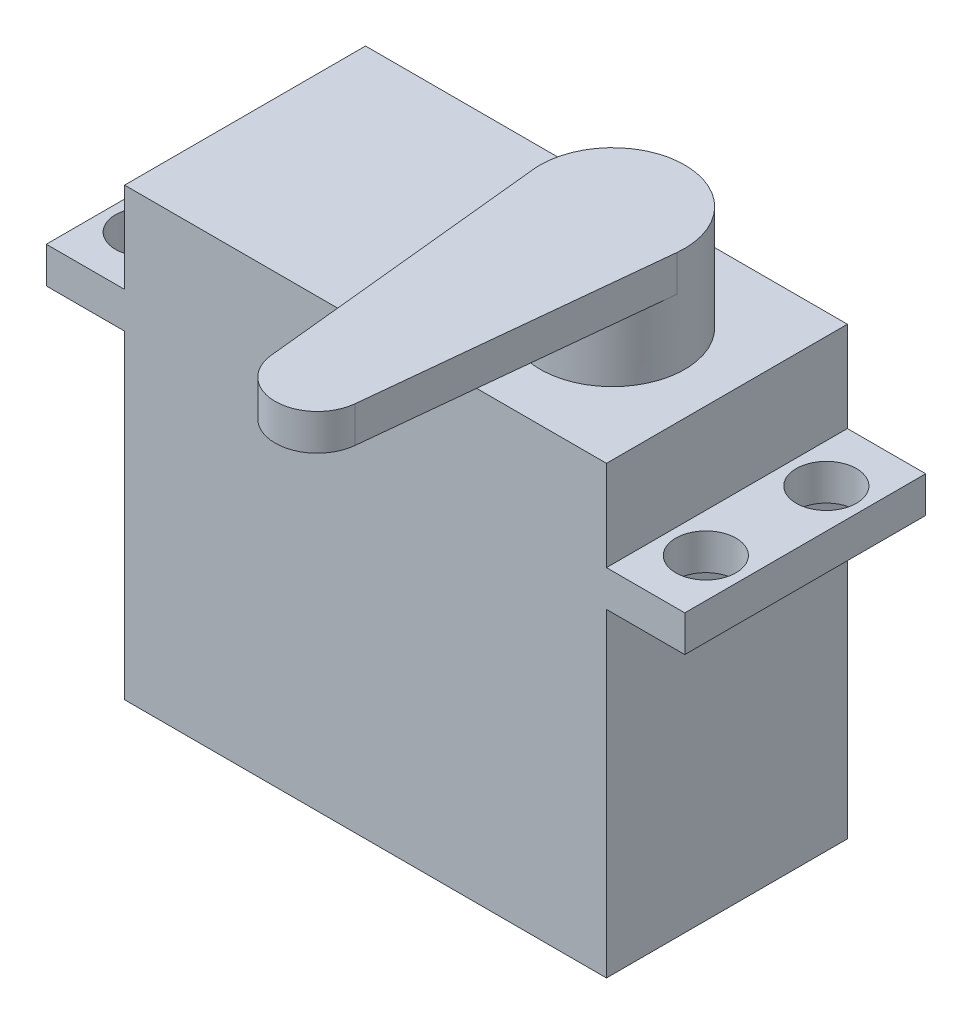
from build123d import *

# Parameters (mm, degrees)
SKETCH1_W           = 40
SKETCH1_H           = 37
BOSS_EXTRUDE1_DEPTH = 20
SKETCH2_W           = 6.5
SKETCH2_H           = 3
BOSS_EXTRUDE2_DEPTH = 20
BOSS_EXTRUDE3_DEPTH = 8.7
BOSS_EXTRUDE4_DEPTH = 3
CUT_EXTRUDE2_REACH  = 67.639
SKETCH5_R           = 2.5


with BuildPart() as part:
    # Sketch1 → Boss-Extrude1 (new body)
    with BuildSketch(Plane.XY):
        with Locations((20, -18.5)):
            Rectangle(SKETCH1_W, SKETCH1_H)
    extrude(amount=BOSS_EXTRUDE1_DEPTH)

    # Sketch2 → Boss-Extrude2 (add)
    with BuildSketch(Plane.XY.offset(20)):
        with Locations((-3.25, -9)):
            Rectangle(SKETCH2_W, SKETCH2_H)
        with Locations((43.25, -9)):
            Rectangle(SKETCH2_W, SKETCH2_H)
    extrude(amount=-BOSS_EXTRUDE2_DEPTH)

    # Sketch3 → Boss-Extrude3 (add)
    with BuildSketch(Plane(origin=(0, 8.7, 0), x_dir=(1, 0, 0), z_dir=(0, 1, 0))):
        with BuildLine():
            ThreePointArc((24.5, -10), (30.5, -16), (36.5, -10))
            Line((36.5, -10), (24.5, -10))
        make_face()
        with BuildLine():
            Line((24.5, -10), (36.5, -10))
            ThreePointArc((36.5, -10), (30.5, -4), (24.5, -10))
        make_face()
    extrude(amount=-BOSS_EXTRUDE3_DEPTH)

    # Sketch4 → Boss-Extrude4 (add)
    with BuildSketch(Plane(origin=(0, 8.7, 0), x_dir=(1, 0, 0), z_dir=(0, 1, 0))):
        with BuildLine():
            Line((33.981730745, -34.857142857), (36.468681277, -10.612244898))
            ThreePointArc((36.468681277, -10.612244898), (30.5, -4), (24.531318723, -10.612244898))
            Line((24.531318723, -10.612244898), (27.018269255, -34.857142857))
            ThreePointArc((27.018269255, -34.857142857), (30.5, -38), (33.981730745, -34.857142857))
        make_face()
    extrude(amount=-BOSS_EXTRUDE4_DEPTH)

    # Sketch5 → Cut-Extrude2 (cut, up to next)
    with BuildSketch(Plane.XZ.offset(10.5), mode=Mode.PRIVATE) as cut_extrude2_sk1:
        with Locations(Location((43.25, 15, 0), (0, 0, 270))):
            Circle(SKETCH5_R)
    cut_extrude2_tool1 = extrude(cut_extrude2_sk1.sketch, amount=-CUT_EXTRUDE2_REACH, mode=Mode.PRIVATE) & part.part
    # Sketch5 → Cut-Extrude2 (cut, up to next)
    with BuildSketch(Plane.XZ.offset(10.5), mode=Mode.PRIVATE) as cut_extrude2_sk2:
        with Locations(Location((43.25, 5, 0), (0, 0, 270))):
            Circle(SKETCH5_R)
    cut_extrude2_tool2 = extrude(cut_extrude2_sk2.sketch, amount=-CUT_EXTRUDE2_REACH, mode=Mode.PRIVATE) & part.part
    # Sketch5 → Cut-Extrude2 (cut, up to next)
    with BuildSketch(Plane.XZ.offset(10.5), mode=Mode.PRIVATE) as cut_extrude2_sk3:
        with Locations(Location((-3.25, 15, 0), (0, 0, 270))):
            Circle(SKETCH5_R)
    cut_extrude2_tool3 = extrude(cut_extrude2_sk3.sketch, amount=-CUT_EXTRUDE2_REACH, mode=Mode.PRIVATE) & part.part
    # Sketch5 → Cut-Extrude2 (cut, up to next)
    with BuildSketch(Plane.XZ.offset(10.5), mode=Mode.PRIVATE) as cut_extrude2_sk4:
        with Locations(Location((-3.25, 5, 0), (0, 0, 270))):
            Circle(SKETCH5_R)
    cut_extrude2_tool4 = extrude(cut_extrude2_sk4.sketch, amount=-CUT_EXTRUDE2_REACH, mode=Mode.PRIVATE) & part.part
    add(cut_extrude2_tool1.solids().sort_by_distance((43.25, -10.5, 15))[0], mode=Mode.SUBTRACT)
    add(cut_extrude2_tool2.solids().sort_by_distance((43.25, -10.5, 5))[0], mode=Mode.SUBTRACT)
    add(cut_extrude2_tool3.solids().sort_by_distance((-3.25, -10.5, 15))[0], mode=Mode.SUBTRACT)
    add(cut_extrude2_tool4.solids().sort_by_distance((-3.25, -10.5, 5))[0], mode=Mode.SUBTRACT)


solid = part.part
